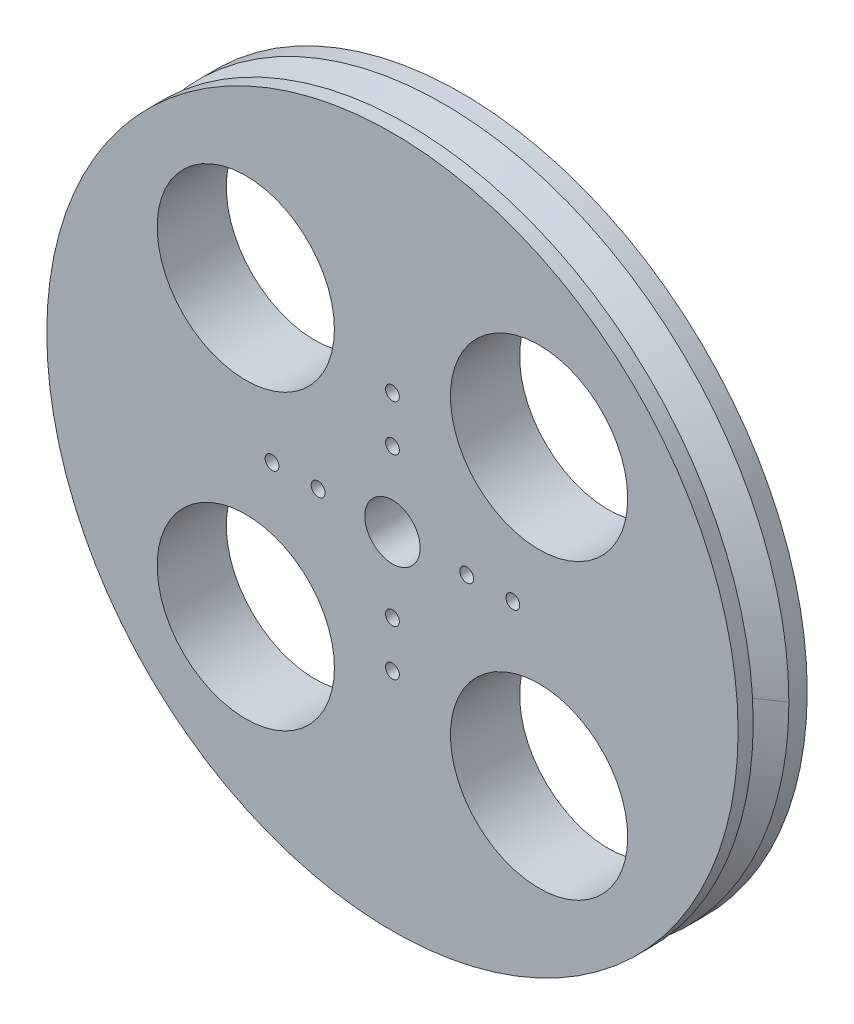
from build123d import *

# Parameters (mm, degrees)
ESQUISSE2_R             = 30
ESQUISSE2_R_2           = 0.6
ESQUISSE2_R_3           = 2.4
ESQUISSE2_R_4           = 7.692251906
BOSS_EXTRU_1_DEPTH      = 6
ENL_V_MAT_EXTRU_1_DEPTH = 2


with BuildPart() as part:
    # Esquisse2 → Boss.-Extru.1 (new body)
    with BuildSketch(Plane.XY):
        Circle(ESQUISSE2_R)
        with Locations((0, 10.45)):
            Circle(ESQUISSE2_R_2, mode=Mode.SUBTRACT)
        with Locations((0, 6.45)):
            Circle(ESQUISSE2_R_2, mode=Mode.SUBTRACT)
        Circle(ESQUISSE2_R_3, mode=Mode.SUBTRACT)
        with Locations((10.45, 0)):
            Circle(ESQUISSE2_R_2, mode=Mode.SUBTRACT)
        with Locations((6.45, 0)):
            Circle(ESQUISSE2_R_2, mode=Mode.SUBTRACT)
        with Locations((0, -10.45)):
            Circle(ESQUISSE2_R_2, mode=Mode.SUBTRACT)
        with Locations((0, -6.45)):
            Circle(ESQUISSE2_R_2, mode=Mode.SUBTRACT)
        with Locations((-10.45, 0)):
            Circle(ESQUISSE2_R_2, mode=Mode.SUBTRACT)
        with Locations((-6.45, 0)):
            Circle(ESQUISSE2_R_2, mode=Mode.SUBTRACT)
        with Locations((-12.727922061, 12.727922061)):
            Circle(ESQUISSE2_R_4, mode=Mode.SUBTRACT)
        with Locations((12.727922061, 12.727922061)):
            Circle(ESQUISSE2_R_4, mode=Mode.SUBTRACT)
        with Locations((12.727922061, -12.727922061)):
            Circle(ESQUISSE2_R_4, mode=Mode.SUBTRACT)
        with Locations((-12.727922061, -12.727922061)):
            Circle(ESQUISSE2_R_4, mode=Mode.SUBTRACT)
    extrude(amount=BOSS_EXTRU_1_DEPTH)

    # Esquisse3 → Enlèv. mat.-Extru.1 (cut)
    with BuildSketch(Plane(origin=(0, 0, 0), x_dir=(-1, 0, 0), z_dir=(0, 0, -1))):
        with BuildLine():
            Line((-2.530820261, -4.390158503), (-1.99702088, -14.159121967))
            ThreePointArc((-1.99702088, -14.159121967), (0, -16.05), (1.99702088, -14.159121967))
            Line((1.99702088, -14.159121967), (2.530820261, -4.390158503))
            ThreePointArc((2.530820261, -4.390158503), (3.583192911, -3.583192911), (4.390158503, -2.530820261))
            Line((4.390158503, -2.530820261), (14.159121967, -1.99702088))
            ThreePointArc((14.159121967, -1.99702088), (16.05, 0), (14.159121967, 1.99702088))
            Line((14.159121967, 1.99702088), (4.390158503, 2.530820261))
            ThreePointArc((4.390158503, 2.530820261), (3.583192911, 3.583192911), (2.530820261, 4.390158503))
            Line((2.530820261, 4.390158503), (1.99702088, 14.159121967))
            ThreePointArc((1.99702088, 14.159121967), (0, 16.05), (-1.99702088, 14.159121967))
            Line((-1.99702088, 14.159121967), (-2.530820261, 4.390158503))
            ThreePointArc((-2.530820261, 4.390158503), (-3.583192911, 3.583192911), (-4.390158503, 2.530820261))
            Line((-4.390158503, 2.530820261), (-14.159121967, 1.99702088))
            ThreePointArc((-14.159121967, 1.99702088), (-16.05, 0), (-14.159121967, -1.99702088))
            Line((-14.159121967, -1.99702088), (-4.390158503, -2.530820261))
            ThreePointArc((-4.390158503, -2.530820261), (-3.583192911, -3.583192911), (-2.530820261, -4.390158503))
        make_face()
    extrude(amount=-ENL_V_MAT_EXTRU_1_DEPTH, mode=Mode.SUBTRACT)

    # Enlèvement de matière-Balayage1: sweep along a curve in space
    with BuildLine() as enl_vement_de_mati_re_balayage1_path:
        ThreePointArc((30, 0, 0), (21.213203436, 21.213203436, 0), (0, 30, 0))
        ThreePointArc((0, 30, 0), (-21.213203436, 21.213203436, 0), (-30, 0, 0))
        ThreePointArc((-30, 0, 0), (-21.213203436, -21.213203436, 0), (0, -30, 0))
        ThreePointArc((0, -30, 0), (21.213203436, -21.213203436, 0), (30, 0, 0))
    # Esquisse4 → Enlèvement de matière-Balayage1 (sweep, cut)
    with BuildSketch(Plane(origin=(0, 0, 0), x_dir=(1, 0, 0), z_dir=(0, 1, 0))):
        Polygon((-31.389656083, -5.473341376), (-27.521569936, -3.290275959), (-31.389656083, -0.638208742), align=None)
    sweep(path=enl_vement_de_mati_re_balayage1_path.line, mode=Mode.SUBTRACT)


solid = part.part
